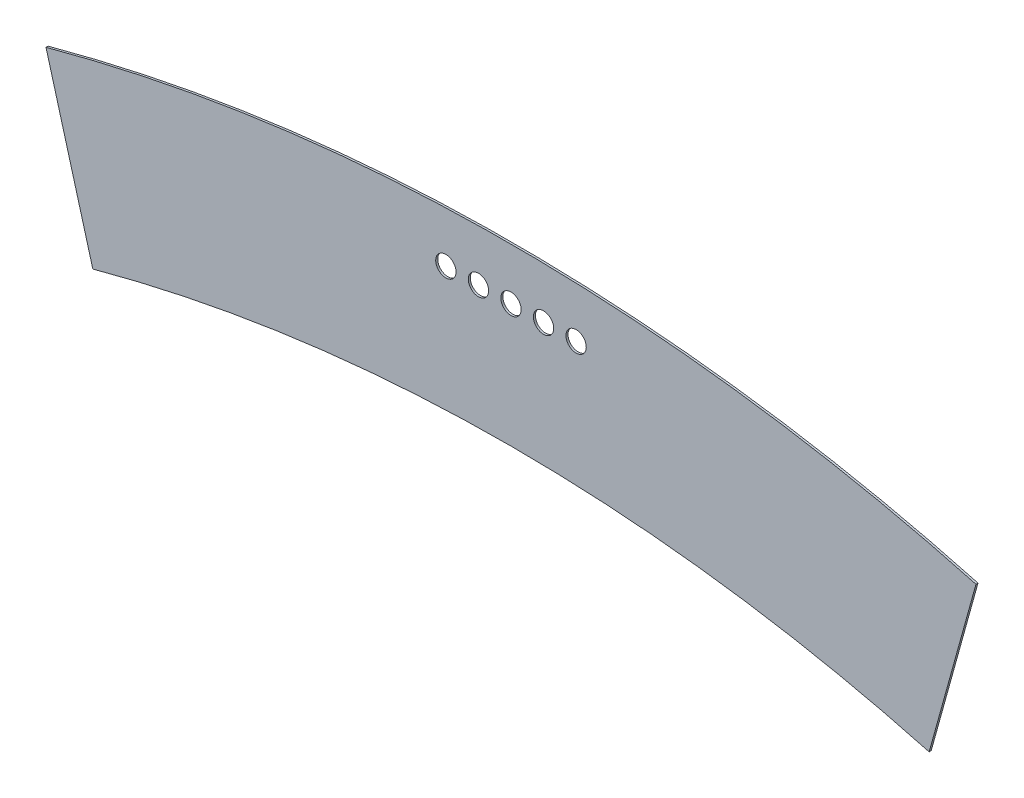
from build123d import *

# Parameters (mm, degrees)
SKETCH1_R          = 15.875
BASE_EXTRUDE_DEPTH = 3.175


with BuildPart() as part:
    # Sketch1 → Base-Extrude (new body)
    with BuildSketch(Plane.XY):
        with BuildLine():
            Line((-725.551, -96.926304331), (-652.5006, -360.027421394))
            ThreePointArc((-652.5006, -360.027421394), (0, -273.05), (652.5006, -360.027421394))
            Line((652.5006, -360.027421394), (725.551, -96.926304331))
            ThreePointArc((725.551, -96.926304331), (0, 0), (-725.551, -96.926304331))
        make_face()
        with Locations((0, -80.7212)):
            Circle(SKETCH1_R, mode=Mode.SUBTRACT)
        with Locations((-50.8, -80.7212)):
            Circle(SKETCH1_R, mode=Mode.SUBTRACT)
        with Locations((-101.6, -80.7212)):
            Circle(SKETCH1_R, mode=Mode.SUBTRACT)
        with Locations((50.8, -80.7212)):
            Circle(SKETCH1_R, mode=Mode.SUBTRACT)
        with Locations((101.6, -80.7212)):
            Circle(SKETCH1_R, mode=Mode.SUBTRACT)
    extrude(amount=-BASE_EXTRUDE_DEPTH)


solid = part.part
